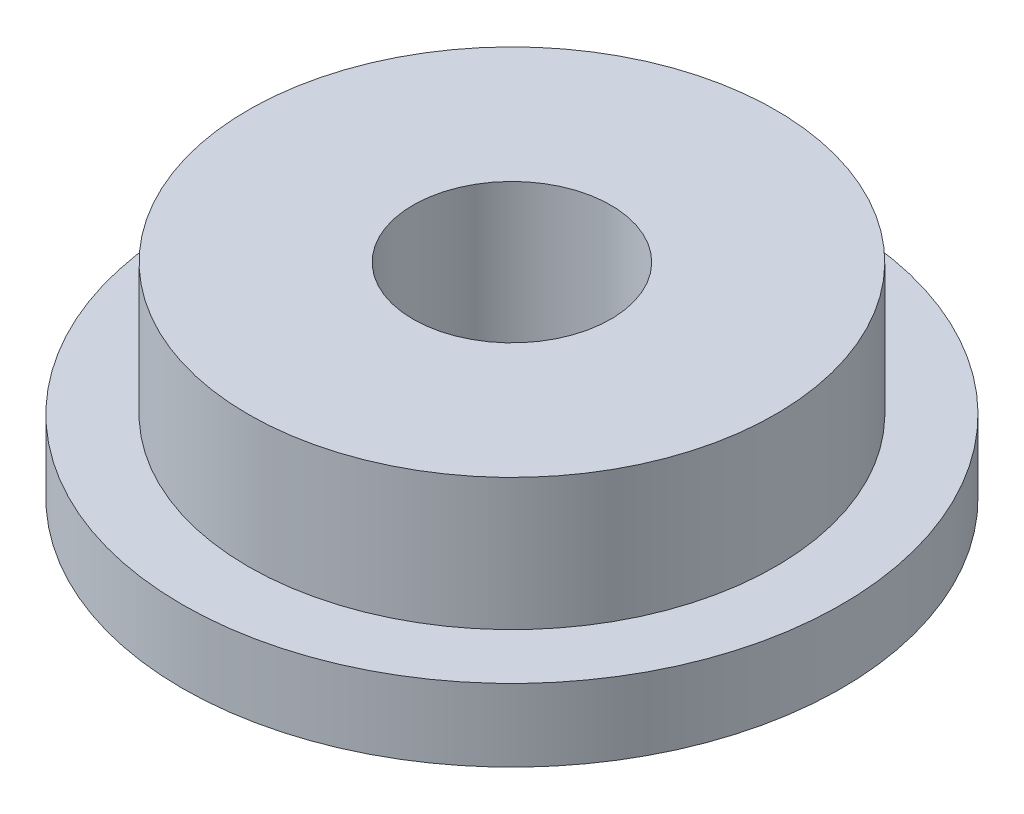
from build123d import *

# Parameters (mm, degrees)
SKETCH1_R           = 5
BOSS_EXTRUDE1_DEPTH = 1.1
SKETCH3_R           = 4
BOSS_EXTRUDE2_DEPTH = 2
SKETCH4_R           = 1.5
CUT_EXTRUDE1_DEPTH  = 8.720751259


with BuildPart() as part:
    # Sketch1 → Boss-Extrude1 (new body)
    with BuildSketch(Plane(origin=(0, 0, 0), x_dir=(1, 0, 0), z_dir=(0, 1, 0))):
        with Locations(Location((0, 0, 0), (0, 0, 270))):
            Circle(SKETCH1_R)
    extrude(amount=BOSS_EXTRUDE1_DEPTH)

    # Sketch3 → Boss-Extrude2 (add)
    with BuildSketch(Plane(origin=(0, 1.1, 0), x_dir=(1, 0, 0), z_dir=(0, 1, 0))):
        with Locations(Location((0, 0, 0), (0, 0, 270))):
            Circle(SKETCH3_R)
    extrude(amount=BOSS_EXTRUDE2_DEPTH)

    # Sketch4 → Cut-Extrude1 (cut, through all)
    with BuildSketch(Plane(origin=(0, 3.1, 0), x_dir=(1, 0, 0), z_dir=(0, 1, 0))):
        with Locations(Location((0, 0, 0), (0, 0, 270))):
            Circle(SKETCH4_R)
    extrude(amount=-CUT_EXTRUDE1_DEPTH, mode=Mode.SUBTRACT)


solid = part.part
